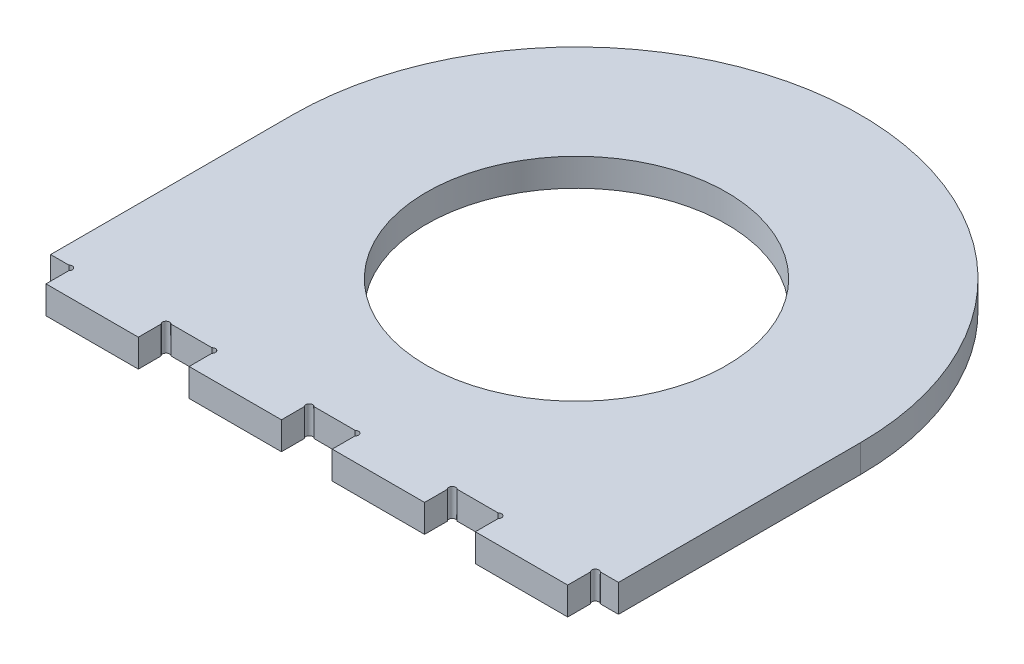
from build123d import *

# Parameters (mm, degrees)
CROQUIS1_R              = 65
SALIENTE_EXTRUIR2_DEPTH = 12


with BuildPart() as part:
    # Croquis1 → Saliente-Extruir2 (new body)
    with BuildSketch(Plane(origin=(0, 0, 0), x_dir=(1, 0, 0), z_dir=(0, 1, 0))):
        with BuildLine():
            Line((57, 0), (57, 104.820295074))
            ThreePointArc((57, 104.820295074), (180, 227.820295074), (303, 104.820295074))
            Line((303, 104.820295074), (303, 0))
            Line((303, 0), (295.121320344, 0))
            ThreePointArc((295.121320344, 0), (293, 0), (293, -2.121320344))
            Line((293, -2.121320344), (293, -12))
            Line((293, -12), (253, -12))
            Line((253, -12), (253, -2.121320344))
            ThreePointArc((253, -2.121320344), (253, 0), (250.878679656, 0))
            Line((250.878679656, 0), (233.121320344, 0))
            ThreePointArc((233.121320344, 0), (231, 0), (231, -2.121320344))
            Line((231, -2.121320344), (231, -12))
            Line((231, -12), (191, -12))
            Line((191, -12), (191, -2.121320344))
            ThreePointArc((191, -2.121320344), (191, 0), (188.878679656, 0))
            Line((188.878679656, 0), (171.121320344, 0))
            ThreePointArc((171.121320344, 0), (169, 0), (169, -2.121320344))
            Line((169, -2.121320344), (169, -12))
            Line((169, -12), (129, -12))
            Line((129, -12), (129, -2.121320344))
            ThreePointArc((129, -2.121320344), (129, 0), (126.878679656, 0))
            Line((126.878679656, 0), (109.121320344, 0))
            ThreePointArc((109.121320344, 0), (107, 0), (107, -2.121320344))
            Line((107, -2.121320344), (107, -12))
            Line((107, -12), (67, -12))
            Line((67, -12), (67, -2.121320344))
            ThreePointArc((67, -2.121320344), (67, 0), (64.878679656, 0))
            Line((64.878679656, 0), (57, 0))
        make_face()
        with Locations(Location((180, 104.820295074, 0), (0, 0, 270))):
            Circle(CROQUIS1_R, mode=Mode.SUBTRACT)
    extrude(amount=SALIENTE_EXTRUIR2_DEPTH)


solid = part.part
